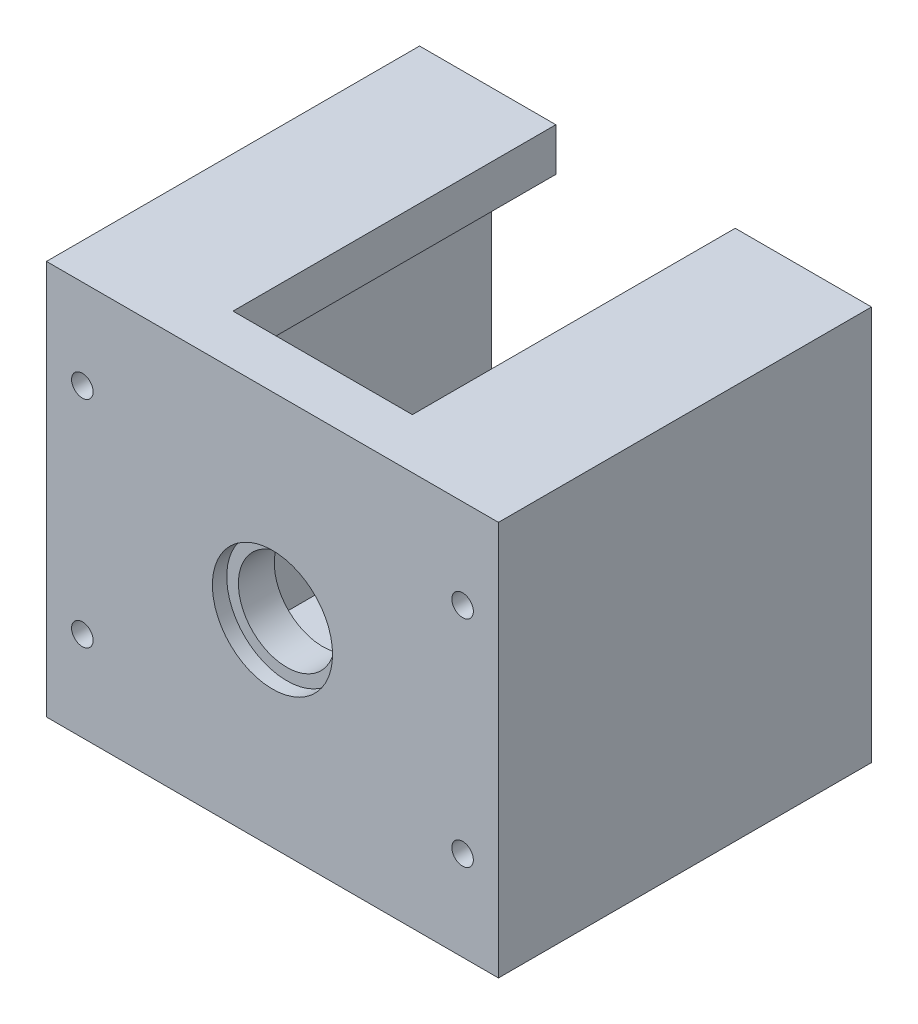
from build123d import *

# Parameters (mm, degrees)
SKETCH1_7_W         = 63
SKETCH1_7_H         = 55
SKETCH1_7_R         = 1.5
SKETCH1_7_R_2       = 8.375
BOSS_EXTRUDE3_DEPTH = 7
BOSS_EXTRUDE4_START = -45
SKETCH1_8_W         = 63
SKETCH1_8_H         = 55
SKETCH1_8_R         = 1.5
SKETCH1_8_W_2       = 43
SKETCH1_8_H_2       = 43
BOSS_EXTRUDE4_DEPTH = 45
SKETCH1_9_R         = 8.375
SKETCH1_9_R_2       = 6.75
BOSS_EXTRUDE5_DEPTH = 5
SKETCH4_W           = 12.5
SKETCH4_H           = 45
CUT_EXTRUDE5_DEPTH  = 6


with BuildPart() as part:
    # Sketch1<7> → Boss-Extrude3 (new body)
    with BuildSketch(Plane.XY):
        with Locations((21.5, 21.5)):
            Rectangle(SKETCH1_7_W, SKETCH1_7_H)
        with Locations((-5, 36.5)):
            Circle(SKETCH1_7_R, mode=Mode.SUBTRACT)
        with Locations((-5, 6.5)):
            Circle(SKETCH1_7_R, mode=Mode.SUBTRACT)
        with Locations((48, 6.5)):
            Circle(SKETCH1_7_R, mode=Mode.SUBTRACT)
        with Locations((48, 36.5)):
            Circle(SKETCH1_7_R, mode=Mode.SUBTRACT)
        with Locations((21.5, 21.5)):
            Circle(SKETCH1_7_R_2, mode=Mode.SUBTRACT)
    extrude(amount=BOSS_EXTRUDE3_DEPTH)

    # Sketch1<8> → Boss-Extrude4 (add)
    with BuildSketch(Plane.XY.offset(BOSS_EXTRUDE4_START)):
        with Locations((21.5, 21.5)):
            Rectangle(SKETCH1_8_W, SKETCH1_8_H)
        with Locations((48, 6.5)):
            Circle(SKETCH1_8_R, mode=Mode.SUBTRACT)
        with Locations((-5, 6.5)):
            Circle(SKETCH1_8_R, mode=Mode.SUBTRACT)
        with Locations((-5, 36.5)):
            Circle(SKETCH1_8_R, mode=Mode.SUBTRACT)
        with Locations((48, 36.5)):
            Circle(SKETCH1_8_R, mode=Mode.SUBTRACT)
        with Locations((21.5, 21.5)):
            Rectangle(SKETCH1_8_W_2, SKETCH1_8_H_2, mode=Mode.SUBTRACT)
    extrude(amount=BOSS_EXTRUDE4_DEPTH)

    # Sketch1<9> → Boss-Extrude5 (add)
    with BuildSketch(Plane.XY):
        with Locations((21.5, 21.5)):
            Circle(SKETCH1_9_R)
        with Locations((21.5, 21.5)):
            Circle(SKETCH1_9_R_2, mode=Mode.SUBTRACT)
    extrude(amount=BOSS_EXTRUDE5_DEPTH)

    # Sketch4 → Cut-Extrude5 (cut)
    with BuildSketch(Plane.XZ.offset(-43)):
        with Locations((27.75, -22.5)):
            Rectangle(SKETCH4_W, SKETCH4_H)
        with Locations((15.25, -22.5)):
            Rectangle(SKETCH4_W, SKETCH4_H)
    extrude(amount=-CUT_EXTRUDE5_DEPTH, mode=Mode.SUBTRACT)


solid = part.part
